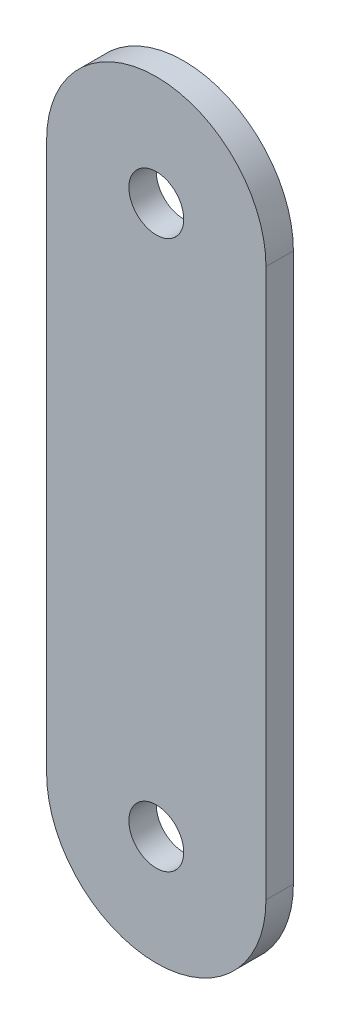
from build123d import *

# Parameters (mm, degrees)
SKETCH1_R           = 12.7
BOSS_EXTRUDE1_DEPTH = 12.7


with BuildPart() as part:
    # Sketch1 → Boss-Extrude1 (new body)
    with BuildSketch(Plane.XY):
        with BuildLine():
            Line((-50.8, -254), (-50.8, 0))
            ThreePointArc((-50.8, 0), (0, 50.8), (50.8, 0))
            Line((50.8, 0), (50.8, -254))
            ThreePointArc((50.8, -254), (0, -304.8), (-50.8, -254))
        make_face()
        Circle(SKETCH1_R, mode=Mode.SUBTRACT)
        with Locations((0, -254)):
            Circle(SKETCH1_R, mode=Mode.SUBTRACT)
    extrude(amount=BOSS_EXTRUDE1_DEPTH)


solid = part.part
